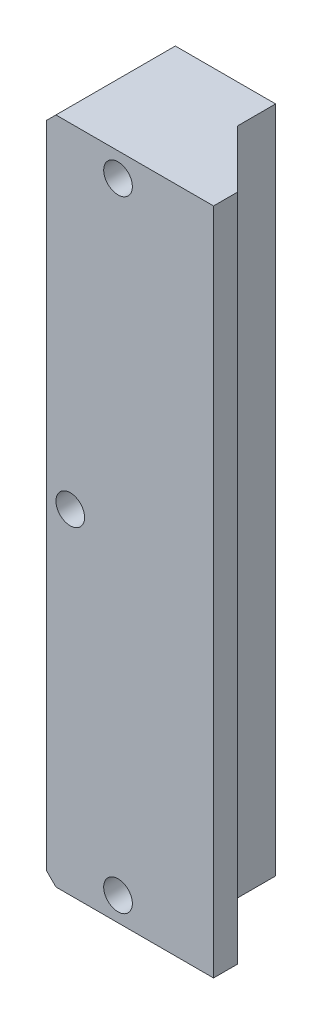
from build123d import *

# Parameters (mm, degrees)
SKETCH1_W                                            = 35
SKETCH1_H                                            = 140
BOSS_EXTRUDE1_DEPTH                                  = 25
CUT_EXTRUDE1_DEPTH                                   = 144.287298809
CUT_EXTRUDE1_DEPTH_BACK                              = 144.287298809
CBORE_FOR_M3_HEXAGON_SOCKET_HEAD_CAP_SCR_D           = 3.2
CBORE_FOR_M3_HEXAGON_SOCKET_HEAD_CAP_SCR_CBORE_D     = 6
CBORE_FOR_M3_HEXAGON_SOCKET_HEAD_CAP_SCR_CBORE_DEPTH = 18.4
CHAMFER1_SIZE                                        = 2


with BuildPart() as part:
    # Sketch1 → Boss-Extrude1 (new body)
    with BuildSketch(Plane.XY):
        Rectangle(SKETCH1_W, SKETCH1_H)
    extrude(amount=BOSS_EXTRUDE1_DEPTH)

    # Sketch2 → Cut-Extrude1 (cut, two sides: drawn at the far end of the back side and taken through both)
    with BuildSketch(Plane.XZ.offset(70).offset(-CUT_EXTRUDE1_DEPTH_BACK)):
        Polygon((5.5, -90.622577483), (5.5, 0), (5.5, 8), (17.5, 20), (81.579839067, 84.079839067), (247.751789779, 11.714868294), (171.671950713, -162.987548256), align=None)
    extrude(amount=CUT_EXTRUDE1_DEPTH + CUT_EXTRUDE1_DEPTH_BACK, mode=Mode.SUBTRACT)

    # CBORE for M3 Hexagon socket head cap screws1 (through all)
    with Locations(Plane.XY.offset(25)):
        with Locations((-2.5, 65), (-12.5, 0), (-2.5, -65)):
            CounterBoreHole(CBORE_FOR_M3_HEXAGON_SOCKET_HEAD_CAP_SCR_D / 2, CBORE_FOR_M3_HEXAGON_SOCKET_HEAD_CAP_SCR_CBORE_D / 2, CBORE_FOR_M3_HEXAGON_SOCKET_HEAD_CAP_SCR_CBORE_DEPTH)

    # Chamfer1
    chamfer1_edges = [part.edges().sort_by_distance(p)[0] for p in [
        (-17.5, -70, 12.5),
        (-17.5, 70, 12.5),
    ]]
    chamfer(chamfer1_edges, length=CHAMFER1_SIZE)


solid = part.part
